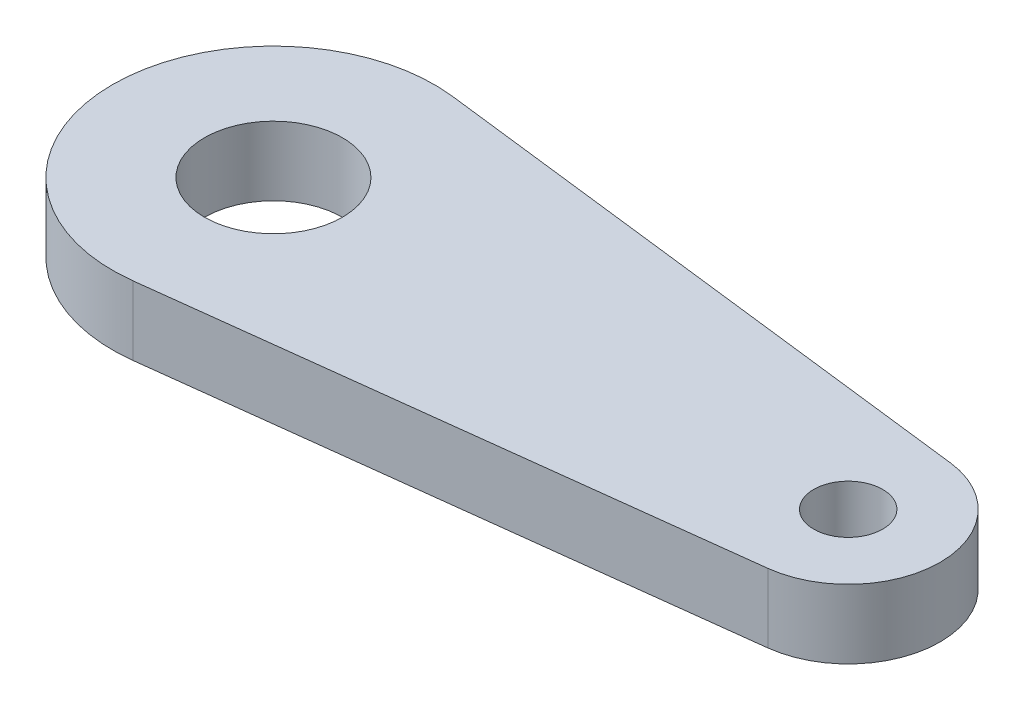
from build123d import *

# Parameters (mm, degrees)
SKETCH1_R           = 3
SKETCH1_R_2         = 1.5
BOSS_EXTRUDE1_DEPTH = 3


with BuildPart() as part:
    # Sketch1 → Boss-Extrude1 (new body)
    with BuildSketch(Plane(origin=(0, 0, 0), x_dir=(1, 0, 0), z_dir=(0, 1, 0))):
        with BuildLine():
            Line((25.48, 3.971095567), (0.84, 6.949417242))
            ThreePointArc((0.84, 6.949417242), (-7, 0), (0.84, -6.949417242))
            Line((0.84, -6.949417242), (25.48, -3.971095567))
            ThreePointArc((25.48, -3.971095567), (29, 0), (25.48, 3.971095567))
        make_face()
        with Locations(Location((0, 0, 0), (0, 0, 270))):
            Circle(SKETCH1_R, mode=Mode.SUBTRACT)
        with Locations(Location((25, 0, 0), (0, 0, 270))):
            Circle(SKETCH1_R_2, mode=Mode.SUBTRACT)
    extrude(amount=BOSS_EXTRUDE1_DEPTH)


solid = part.part
